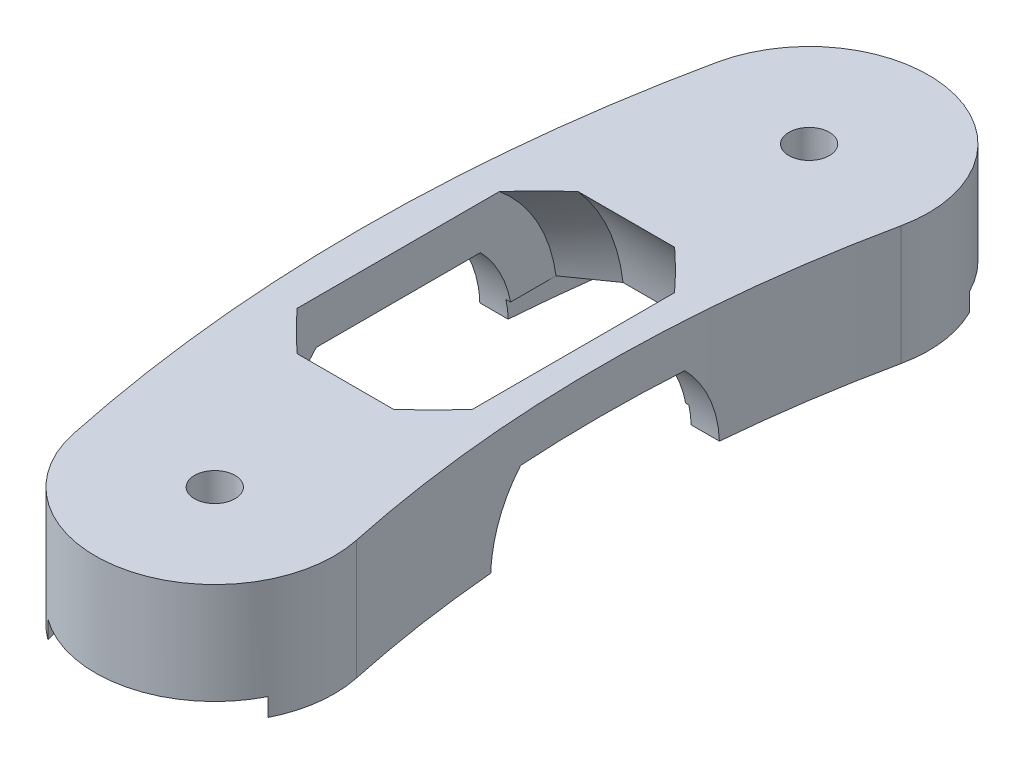
from build123d import *
from build123d.topology import SkipClean

# Parameters (mm, degrees)
SKETCH1_R           = 1.4
BOSS_EXTRUDE1_DEPTH = 7
BOSS_EXTRUDE2_START = 1.25
BOSS_EXTRUDE2_DEPTH = 1.25
BOSS_EXTRUDE3_START = -3
BOSS_EXTRUDE3_DEPTH = 3
CUT_EXTRUDE1_DEPTH  = 0.2


with BuildPart() as part:
    # Sketch1 → Boss-Extrude1 (new body)
    with BuildSketch(Plane(origin=(0, 0, 0), x_dir=(1, 0, 0), z_dir=(0, 1, 0))):
        with BuildLine():
            ThreePointArc((0.338206721, -22.246550918), (10.123195877, -28.600997174), (16.477642134, -18.816008019))
            ThreePointArc((16.477642134, -18.816008019), (14.5, 0), (16.477642134, 18.816008019))
            ThreePointArc((16.477642134, 18.816008019), (10.123195877, 28.600997174), (0.338206721, 22.246550918))
            ThreePointArc((0.338206721, 22.246550918), (-2, 0), (0.338206721, -22.246550918))
        make_face()
        with Locations((8.407924428, -20.531279468)):
            Circle(SKETCH1_R, mode=Mode.SUBTRACT)
        with Locations((8.407924428, 20.531279468)):
            Circle(SKETCH1_R, mode=Mode.SUBTRACT)
    extrude(amount=BOSS_EXTRUDE1_DEPTH)

    # Sketch9 → Boss-Extrude2 (add)
    with SkipClean():  # the faces are left unmerged after this step: merging them gives an invalid solid
        with BuildSketch(Plane.XZ.offset(BOSS_EXTRUDE2_START)):
            with BuildLine():
                ThreePointArc((16.477642134, 18.816008019), (16.590657489, 21.582649832), (15.781907349, 24.230857264))
                ThreePointArc((15.781907349, 24.230857264), (12.55, 0), (15.781907349, -24.230857264))
                ThreePointArc((15.781907349, -24.230857264), (16.590657489, -21.582649832), (16.477642134, -18.816008019))
                ThreePointArc((16.477642134, -18.816008019), (14.5, 0), (16.477642134, 18.816008019))
            make_face()
            with BuildLine():
                ThreePointArc((3.527962455, -27.1832319), (-0.05, 0), (3.527962455, 27.1832319))
                ThreePointArc((3.527962455, 27.1832319), (1.478548141, 25.008582705), (0.338206721, 22.246550918))
                ThreePointArc((0.338206721, 22.246550918), (-2, 0), (0.338206721, -22.246550918))
                ThreePointArc((0.338206721, -22.246550918), (1.478548141, -25.008582705), (3.527962455, -27.1832319))
            make_face()
        extrude(amount=-BOSS_EXTRUDE2_DEPTH)

    # Sketch7 → Cut-Revolve1 (revolve, cut)
    with SkipClean():  # the faces are left unmerged after this step: merging them gives an invalid solid
        with BuildSketch(Plane.XZ.offset(1.5)):
            Polygon((-2.827829401, 7.9), (-2.827829401, 0), (15.300032557, 0), (15.300032557, 7.9), (12.656364897, 7.9), (12.656364897, 11), (9.942883684, 12.9), (3.269846109, 12.9), (0.556364897, 11), (0.556364897, 7.9), align=None)
        revolve(axis=Axis((-2.827829401, -1.5, 0), (1, 0, 0)), mode=Mode.SUBTRACT)

    # Sketch10 → Boss-Extrude3 (add)
    with SkipClean():  # the faces are left unmerged after this step: merging them gives an invalid solid
        with BuildSketch(Plane(origin=(0, 7, 0), x_dir=(1, 0, 0), z_dir=(0, 1, 0)).offset(BOSS_EXTRUDE3_START)):
            with BuildLine():
                Line((0.556364897, -23.064165753), (0.556364897, 23.064165753))
                ThreePointArc((0.556364897, 23.064165753), (0.436795855, 22.658157293), (0.338206721, 22.246550918))
                ThreePointArc((0.338206721, 22.246550918), (-2, 0), (0.338206721, -22.246550918))
                ThreePointArc((0.338206721, -22.246550918), (0.436795855, -22.658157293), (0.556364897, -23.064165753))
            make_face()
            with BuildLine():
                ThreePointArc((16.477642134, 18.816008019), (15.973524979, 23.821292887), (12.656364897, 27.603284388))
                Line((12.656364897, 27.603284388), (12.656364897, -27.603284388))
                ThreePointArc((12.656364897, -27.603284388), (15.973524979, -23.821292887), (16.477642134, -18.816008019))
                ThreePointArc((16.477642134, -18.816008019), (14.5, 0), (16.477642134, 18.816008019))
            make_face()
        extrude(amount=BOSS_EXTRUDE3_DEPTH)

    # Sketch11 → Cut-Extrude1 (cut)
    # profile 1 of 3: a face of its own
    with SkipClean():  # the faces are left unmerged after this step: merging them gives an invalid solid
        with BuildSketch(Plane.XZ):
            with BuildLine():
                Line((5.858884849, 22.055267594), (5.858884849, 25.555267594))
                Line((5.858884849, 25.555267594), (6.565615619, 25.555267594))
                add(Edge.make_bspline(
                    [(6.565615619, 25.555267594), (6.627084607, 25.554825024), (6.745842372, 25.553969981), (6.91745482, 25.54854859), (7.076238582, 25.538958124), (7.221671441, 25.524988598), (7.354152653, 25.507835564), (7.473311261, 25.48633516), (7.579763404, 25.460946989), (7.645232845, 25.439301539), (7.676192542, 25.429065671)],
                    knots=[0, 0, 0, 0, 1.314313732, 2.53924729, 3.670748893, 4.714932338, 5.66265055, 6.526160246, 7.303039223, 8, 8, 8, 8], degree=3))
                add(Edge.make_bspline(
                    [(7.676192542, 25.429065671), (7.716687281, 25.413634965), (7.796758473, 25.383123471), (7.910765596, 25.325567169), (8.018090959, 25.260354068), (8.119310104, 25.187398205), (8.21211093, 25.104633857), (8.300118827, 25.015576771), (8.379733551, 24.916988431), (8.452641847, 24.810913443), (8.518377506, 24.698601391), (8.575516664, 24.580266282), (8.622970657, 24.456509074), (8.662363884, 24.327673926), (8.693410341, 24.193477548), (8.714592273, 24.053763682), (8.728563263, 23.909084493), (8.729967314, 23.810910029), (8.730679721, 23.761096921)],
                    knots=[0, 0, 0, 0, 0.984719456, 1.947108742, 2.898477687, 3.838006223, 4.779231079, 5.722358779, 6.681677486, 7.655904652, 8.64651281, 9.637519902, 10.640069247, 11.656948941, 12.698408672, 13.768548281, 14.867775369, 16, 16, 16, 16], degree=3))
                add(Edge.make_bspline(
                    [(8.730679721, 23.761096921), (8.730050754, 23.717835682), (8.728811308, 23.632584893), (8.717681992, 23.506943997), (8.701505672, 23.385030426), (8.676461474, 23.267424726), (8.64605896, 23.153096508), (8.607094809, 23.043264264), (8.562459313, 22.936920455), (8.510409434, 22.835502979), (8.453268049, 22.739419606), (8.391946306, 22.648844078), (8.326509611, 22.565068856), (8.256333978, 22.487840244), (8.182326261, 22.417274666), (8.104001931, 22.352782651), (8.02115888, 22.295626096), (7.934168157, 22.243558988), (7.840492028, 22.198138632), (7.738356162, 22.159708622), (7.627324984, 22.127862007), (7.507671027, 22.101291111), (7.379187549, 22.080213808), (7.241748583, 22.066087416), (7.095565294, 22.056534483), (6.995186028, 22.05569809), (6.943520266, 22.055267594)],
                    knots=[0, 0, 0, 0, 1.105936401, 2.179363191, 3.223086493, 4.248585256, 5.251745608, 6.245858792, 7.225916811, 8.198733463, 9.158002045, 10.082870192, 10.993790845, 11.873723703, 12.748670949, 13.606408763, 14.465103618, 15.319838547, 16.196477973, 17.123216899, 18.106603292, 19.147568657, 20.255746949, 21.433717677, 22.679120308, 24, 24, 24, 24], degree=3))
                Line((6.943520266, 22.055267594), (5.858884849, 22.055267594))
            make_face()
            with BuildLine():
                Line((6.172987413, 22.414241953), (6.574730202, 22.414241953))
                add(Edge.make_bspline(
                    [(6.574730202, 22.414241953), (6.632458573, 22.414490049), (6.743491371, 22.414967229), (6.903149368, 22.419154432), (7.049028765, 22.42599637), (7.181150274, 22.435571448), (7.299439298, 22.448240063), (7.404143048, 22.462364966), (7.494918307, 22.479962416), (7.549847744, 22.495913376), (7.575231003, 22.503284421)],
                    knots=[0, 0, 0, 0, 1.375205317, 2.645023457, 3.804390687, 4.853969522, 5.800190428, 6.637939096, 7.370582563, 8, 8, 8, 8], degree=3))
                add(Edge.make_bspline(
                    [(7.575231003, 22.503284421), (7.607179365, 22.514535979), (7.670313003, 22.536770352), (7.761194089, 22.577328013), (7.845951093, 22.625370083), (7.926061119, 22.678772357), (8.000387774, 22.739418359), (8.06981189, 22.805989348), (8.134193692, 22.878824123), (8.192868, 22.957832284), (8.245376304, 23.04252208), (8.290847533, 23.132060914), (8.330699065, 23.225467724), (8.361977657, 23.324176883), (8.386493241, 23.427305941), (8.403857929, 23.534862154), (8.414672654, 23.646825436), (8.415934102, 23.72297756), (8.416577157, 23.761798042)],
                    knots=[0, 0, 0, 0, 0.998632004, 1.973411704, 2.929992603, 3.868527914, 4.809262121, 5.754881198, 6.702106254, 7.672490631, 8.653608572, 9.636854334, 10.631411391, 11.644891563, 12.686317036, 13.754757253, 14.855430412, 16, 16, 16, 16], degree=3))
                add(Edge.make_bspline(
                    [(8.416577157, 23.761798042), (8.41606387, 23.802731523), (8.415055512, 23.883145707), (8.402381202, 24.001136402), (8.383859646, 24.114617053), (8.35707596, 24.223595248), (8.322945081, 24.3282836), (8.28035044, 24.428103111), (8.23168382, 24.524107979), (8.173780483, 24.614082345), (8.11036489, 24.699175454), (8.039987011, 24.77713037), (7.963764972, 24.84812467), (7.882530123, 24.913263983), (7.793993023, 24.969927659), (7.700239333, 25.02061434), (7.599893662, 25.063630231), (7.530080966, 25.086509094), (7.494601997, 25.098136183)],
                    knots=[0, 0, 0, 0, 1.122418816, 2.205001699, 3.251619955, 4.274784885, 5.280384055, 6.268708349, 7.249350384, 8.229342522, 9.199999885, 10.157847722, 11.105861043, 12.055065948, 13.010012805, 13.98527497, 14.976112212, 16, 16, 16, 16], degree=3))
                add(Edge.make_bspline(
                    [(7.494601997, 25.098136183), (7.46525085, 25.106252611), (7.40284226, 25.123510364), (7.301002796, 25.142335736), (7.186387647, 25.158940235), (7.058487946, 25.172998275), (6.917449486, 25.183085596), (6.763163798, 25.190656911), (6.595564194, 25.195763543), (6.47938166, 25.19611225), (6.419081163, 25.196293235)],
                    knots=[0, 0, 0, 0, 0.674548936, 1.434276114, 2.292660221, 3.240891867, 4.284742987, 5.42552168, 6.663806718, 8, 8, 8, 8], degree=3))
                Line((6.419081163, 25.196293235), (6.172987413, 25.196293235))
                Line((6.172987413, 25.196293235), (6.172987413, 22.414241953))
            make_face(mode=Mode.SUBTRACT)
        # profile 2 of 3: a face of its own
        with BuildSketch(Plane.XZ):
            with BuildLine():
                add(Edge.make_bspline(
                    [(9.695423311, 22.593729132), (9.714913523, 22.592570965), (9.753121805, 22.590300515), (9.808360934, 22.574723841), (9.858355593, 22.547065181), (9.902887838, 22.510202402), (9.939594315, 22.465506739), (9.968238667, 22.415910831), (9.983679652, 22.360209238), (9.985933564, 22.321779563), (9.987089978, 22.302062465)],
                    knots=[0, 0, 0, 0, 1.020151414, 1.999887582, 2.974338812, 3.990962822, 5.007586832, 5.987933904, 6.967670073, 8, 8, 8, 8], degree=3))
                add(Edge.make_bspline(
                    [(9.987089978, 22.302062465), (9.985894377, 22.282819136), (9.98353667, 22.244871572), (9.968274062, 22.189590109), (9.939376011, 22.139963205), (9.903141018, 22.094661067), (9.858344585, 22.057720196), (9.808242738, 22.030296851), (9.75325148, 22.013604871), (9.714935157, 22.011478574), (9.695423311, 22.010395799)],
                    knots=[0, 0, 0, 0, 1.009421747, 1.99056486, 2.972319754, 3.999869655, 5.017953583, 5.993804169, 6.978383603, 8, 8, 8, 8], degree=3))
                add(Edge.make_bspline(
                    [(9.695423311, 22.010395799), (9.675897405, 22.011439396), (9.637777723, 22.013476771), (9.582991728, 22.030639577), (9.53258476, 22.057463037), (9.487797048, 22.094729947), (9.451258576, 22.13973009), (9.423633194, 22.189931887), (9.407043045, 22.244713324), (9.404861172, 22.282787967), (9.403756644, 22.302062465)],
                    knots=[0, 0, 0, 0, 1.022052826, 1.995314843, 2.982371812, 4.00089066, 5.028879526, 6.005146991, 6.990147033, 8, 8, 8, 8], degree=3))
                add(Edge.make_bspline(
                    [(9.403756644, 22.302062465), (9.404818743, 22.321811845), (9.406892362, 22.360370085), (9.423668022, 22.415569193), (9.451044234, 22.465737632), (9.488049629, 22.510134212), (9.532573925, 22.547321515), (9.58287013, 22.574386308), (9.63790967, 22.59042672), (9.675919609, 22.592609237), (9.695423311, 22.593729132)],
                    knots=[0, 0, 0, 0, 1.032775665, 2.016367738, 2.991239715, 4.008302682, 5.025365648, 6.011011707, 6.979408107, 8, 8, 8, 8], degree=3))
            make_face()
        # profile 3 of 3: a face of its own
        with BuildSketch(Plane.XZ):
            Polygon((11.179698151, 25.555267594), (11.826833567, 25.555267594), (11.826833567, 22.055267594), (11.512731003, 22.055267594), (11.512731003, 25.196293235), (10.974269465, 25.196293235), align=None)
        extrude(amount=-CUT_EXTRUDE1_DEPTH, mode=Mode.SUBTRACT)


solid = part.part
